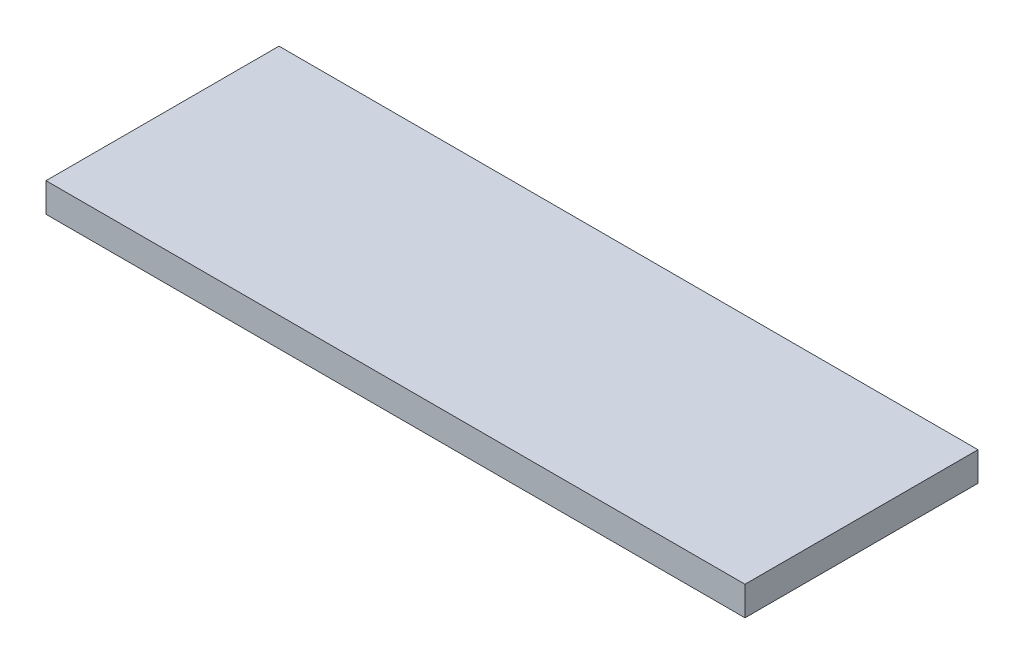
from build123d import *

# Parameters (mm, degrees)
SKETCH1_W           = 228.6
SKETCH1_H           = 76.2
BOSS_EXTRUDE1_DEPTH = 9.525


with BuildPart() as part:
    # Sketch1 → Boss-Extrude1 (new body)
    with BuildSketch(Plane(origin=(0, 0, 0), x_dir=(1, 0, 0), z_dir=(0, 1, 0))):
        Rectangle(SKETCH1_W, SKETCH1_H)
    extrude(amount=BOSS_EXTRUDE1_DEPTH)


solid = part.part
